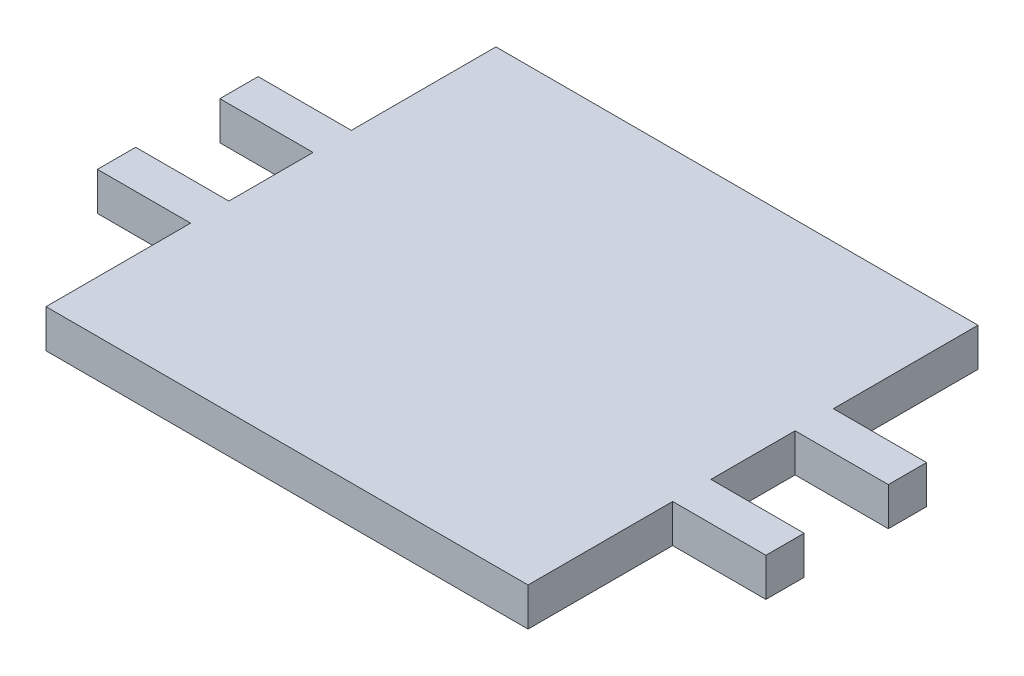
from build123d import *

# Parameters (mm, degrees)
SKETCH1_W           = 76.2
SKETCH1_H           = 71.12
SKETCH1_W_2         = 14.732
SKETCH1_H_2         = 6.0452
BOSS_EXTRUDE1_DEPTH = 6.0452


with BuildPart() as part:
    # Sketch1 → Boss-Extrude1 (new body)
    with BuildSketch(Plane(origin=(0, 0, 0), x_dir=(1, 0, 0), z_dir=(0, 1, 0))):
        Rectangle(SKETCH1_W, SKETCH1_H)
        with Locations((-45.466, -9.6774)):
            Rectangle(SKETCH1_W_2, SKETCH1_H_2)
        with Locations((-45.466, 9.6774)):
            Rectangle(SKETCH1_W_2, SKETCH1_H_2)
        with Locations((45.466, 9.6774)):
            Rectangle(SKETCH1_W_2, SKETCH1_H_2)
        with Locations((45.466, -9.6774)):
            Rectangle(SKETCH1_W_2, SKETCH1_H_2)
    extrude(amount=BOSS_EXTRUDE1_DEPTH)


solid = part.part
